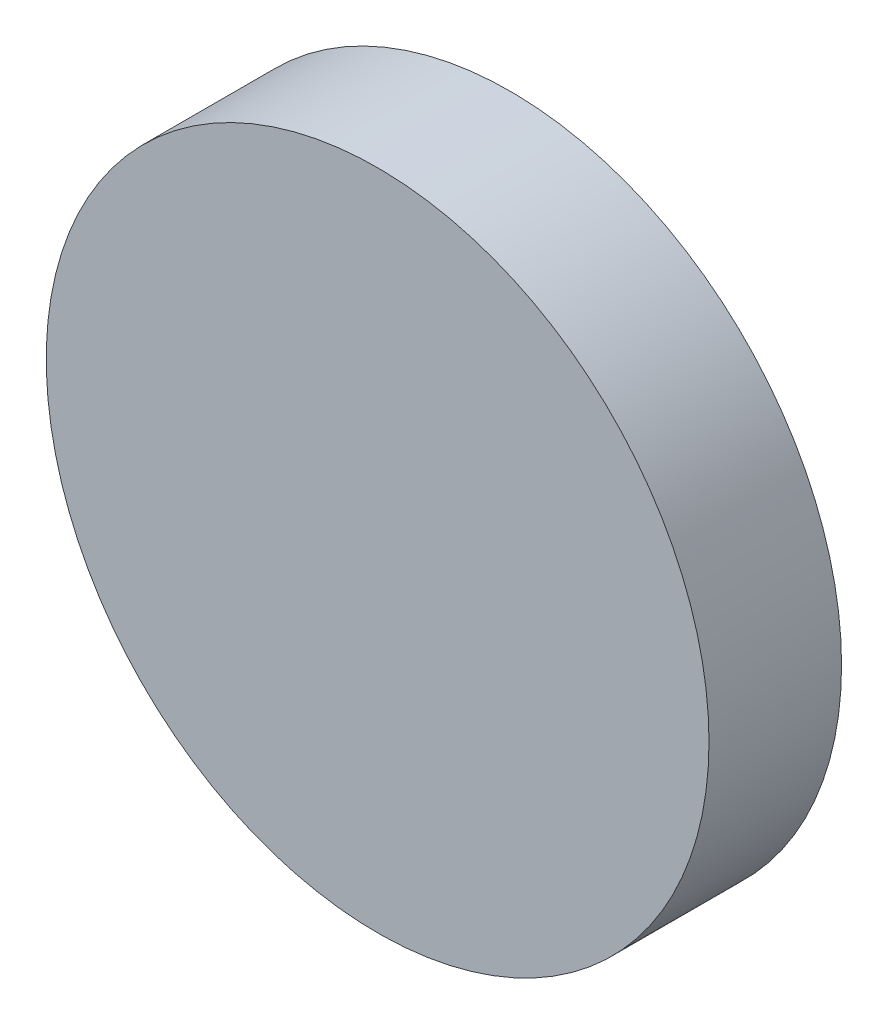
from build123d import *

# Parameters (mm, degrees)
SKIZZE2_R                       = 5
AUFSATZ_LINEAR_AUSTRAGEN1_DEPTH = 2


with BuildPart() as part:
    # Skizze2 → Aufsatz-Linear austragen1 (new body)
    with BuildSketch(Plane.XY):
        Circle(SKIZZE2_R)
    extrude(amount=AUFSATZ_LINEAR_AUSTRAGEN1_DEPTH)


solid = part.part
